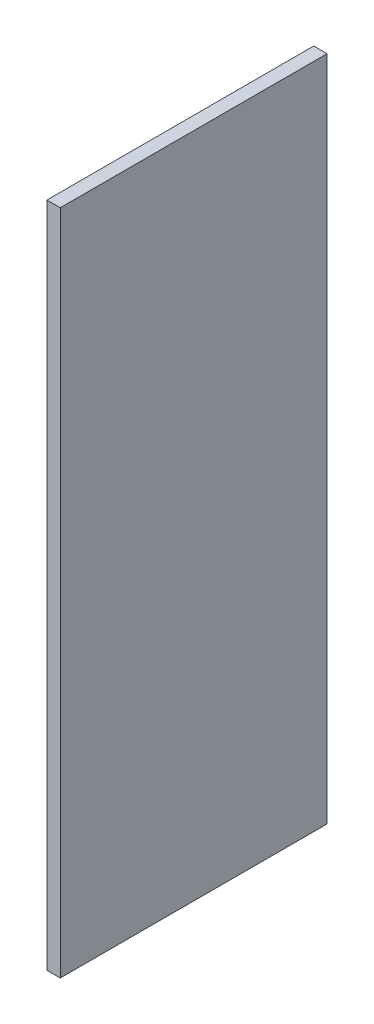
from build123d import *

# Parameters (mm, degrees)
SKETCH1_W           = 20
SKETCH1_H           = 50
BOSS_EXTRUDE1_DEPTH = 1


with BuildPart() as part:
    # Sketch1 → Boss-Extrude1 (new body)
    with BuildSketch(Plane(origin=(0, 0, 0), x_dir=(0, 0, -1), z_dir=(1, 0, 0))):
        with Locations((0, 25)):
            Rectangle(SKETCH1_W, SKETCH1_H)
    extrude(amount=BOSS_EXTRUDE1_DEPTH)


solid = part.part
